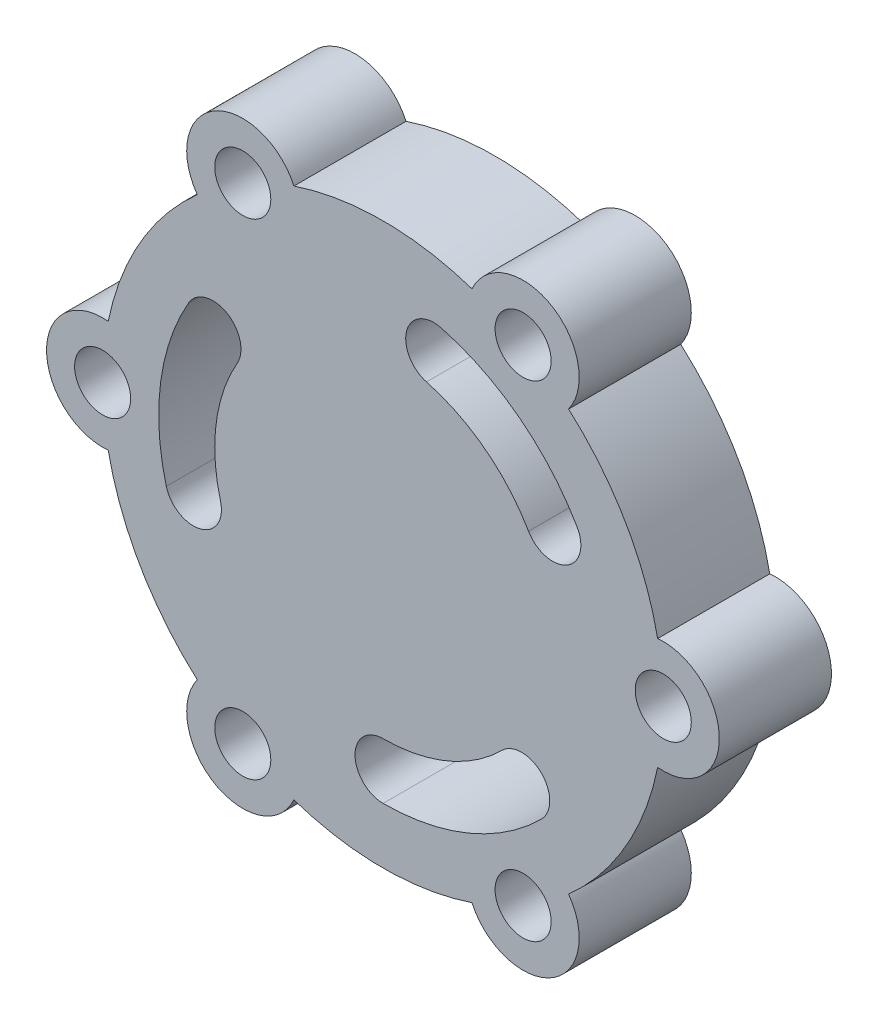
from build123d import *

# Parameters (mm, degrees)
SKETCH1_R           = 5
BOSS_EXTRUDE1_DEPTH = 20


with BuildPart() as part:
    # Sketch1 → Boss-Extrude1 (new body)
    with BuildSketch(Plane.XY):
        with BuildLine():
            ThreePointArc((119, 60.050125629), (130, 70), (119, 79.949874371))
            ThreePointArc((119, 79.949874371), (113.301270189, 95), (103.11684397, 107.4603076))
            ThreePointArc((103.11684397, 107.4603076), (100, 121.961524227), (85.88315603, 117.410181971))
            ThreePointArc((85.88315603, 117.410181971), (70, 120), (54.11684397, 117.410181971))
            ThreePointArc((54.11684397, 117.410181971), (40, 121.961524227), (36.88315603, 107.4603076))
            ThreePointArc((36.88315603, 107.4603076), (26.698729811, 95), (21, 79.949874371))
            ThreePointArc((21, 79.949874371), (10, 70), (21, 60.050125629))
            ThreePointArc((21, 60.050125629), (26.698729811, 45), (36.88315603, 32.5396924))
            ThreePointArc((36.88315603, 32.5396924), (40, 18.038475773), (54.11684397, 22.589818029))
            ThreePointArc((54.11684397, 22.589818029), (70, 20), (85.88315603, 22.589818029))
            ThreePointArc((85.88315603, 22.589818029), (100, 18.038475773), (103.11684397, 32.5396924))
            ThreePointArc((103.11684397, 32.5396924), (113.301270189, 45), (119, 60.050125629))
        make_face()
        with Locations((120, 70)):
            Circle(SKETCH1_R, mode=Mode.SUBTRACT)
        with Locations((95, 26.698729811)):
            Circle(SKETCH1_R, mode=Mode.SUBTRACT)
        with Locations((45, 26.698729811)):
            Circle(SKETCH1_R, mode=Mode.SUBTRACT)
        with Locations((20, 70)):
            Circle(SKETCH1_R, mode=Mode.SUBTRACT)
        with Locations((45, 113.301270189)):
            Circle(SKETCH1_R, mode=Mode.SUBTRACT)
        with Locations((95, 113.301270189)):
            Circle(SKETCH1_R, mode=Mode.SUBTRACT)
        with BuildLine():
            ThreePointArc((104.627429298, 90.023514682), (94.339682915, 101.742398075), (80.352761804, 108.637033052))
            ThreePointArc((80.352761804, 108.637033052), (74.229037447, 105.101499146), (77.764571353, 98.977774789))
            ThreePointArc((77.764571353, 98.977774789), (88.254762186, 93.806798557), (95.970571973, 85.017636011))
            ThreePointArc((95.970571973, 85.017636011), (102.801939971, 83.192146685), (104.627429298, 90.023514682))
        make_face(mode=Mode.SUBTRACT)
        with BuildLine():
            ThreePointArc((70.020368304, 40.000006914), (81.48991124, 42.287512928), (91.213203436, 48.786796564))
            ThreePointArc((91.213203436, 48.786796564), (98.284271247, 48.786796564), (98.284271247, 41.715728753))
            ThreePointArc((98.284271247, 41.715728753), (85.319881653, 33.050017238), (70.027157739, 30.000009219))
            ThreePointArc((70.027157739, 30.000009219), (65.023764174, 34.99661335), (70.020368304, 40.000006914))
        make_face(mode=Mode.SUBTRACT)
        with BuildLine():
            ThreePointArc((44.009059723, 84.982357074), (40.255326574, 73.905688515), (41.022225211, 62.235428647))
            ThreePointArc((41.022225211, 62.235428647), (37.486691305, 56.11170429), (31.362966948, 59.647238196))
            ThreePointArc((31.362966948, 59.647238196), (30.340435432, 75.207584687), (35.345412963, 89.976476099))
            ThreePointArc((35.345412963, 89.976476099), (42.174295855, 91.811239966), (44.009059723, 84.982357074))
        make_face(mode=Mode.SUBTRACT)
    extrude(amount=BOSS_EXTRUDE1_DEPTH)


solid = part.part
